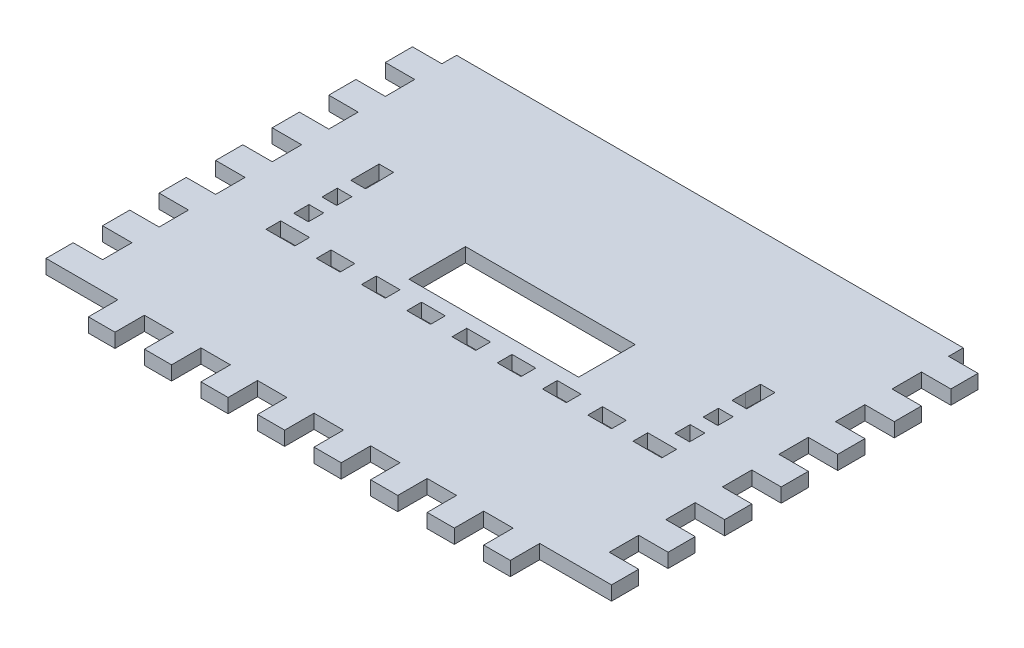
from build123d import *

# Parameters (mm, degrees)
SKETCH1_W           = 127
SKETCH1_H           = 107.95
BOSS_EXTRUDE1_DEPTH = 3.175
SKETCH2_W           = 6.604
SKETCH2_H           = 6.604
CUT_EXTRUDE1_DEPTH  = 84.400427157
SKETCH3_W           = 6.477
SKETCH3_H           = 3.302
SKETCH3_W_2         = 3.302
SKETCH3_H_2         = 3.429
SKETCH3_W_3         = 5.334
SKETCH3_W_4         = 38.1
SKETCH3_H_3         = 12.7
CUT_EXTRUDE2_DEPTH  = 84.400427157


with BuildPart() as part:
    # Sketch1 → Boss-Extrude1 (new body)
    with BuildSketch(Plane(origin=(0, 0, 0), x_dir=(1, 0, 0), z_dir=(0, 1, 0))):
        Rectangle(SKETCH1_W, SKETCH1_H)
    extrude(amount=BOSS_EXTRUDE1_DEPTH)

    # Sketch2 → Cut-Extrude1 (cut, through all)
    with BuildSketch(Plane.XZ):
        with Locations((60.198, 22.225)):
            Rectangle(SKETCH2_W, SKETCH2_H)
        Polygon((63.5, 38.227), (63.5, 31.623), (56.896, 31.623), (47.371, 31.623), (47.371, 38.227), (41.402, 38.227), (41.402, 31.623), (34.798, 31.623), (34.798, 38.227), (28.702, 38.227), (28.702, 31.623), (22.098, 31.623), (22.098, 38.227), (16.002, 38.227), (16.002, 31.623), (9.398, 31.623), (9.398, 38.227), (3.302, 38.227), (3.302, 31.623), (-3.302, 31.623), (-3.302, 38.227), (-9.398, 38.227), (-9.398, 31.623), (-16.002, 31.623), (-16.002, 38.227), (-22.098, 38.227), (-22.098, 31.623), (-28.702, 31.623), (-28.702, 38.227), (-34.798, 38.227), (-34.798, 31.623), (-41.402, 31.623), (-41.402, 38.227), (-47.371, 38.227), (-47.371, 31.623), (-56.896, 31.623), (-63.5, 31.623), (-63.5, 38.227), (-63.5, 53.975), (63.5, 53.975), align=None)
        with Locations((60.198, 9.525)):
            Rectangle(SKETCH2_W, SKETCH2_H)
        with Locations((60.198, -3.175)):
            Rectangle(SKETCH2_W, SKETCH2_H)
        with Locations((60.198, -15.875)):
            Rectangle(SKETCH2_W, SKETCH2_H)
        with Locations((60.198, -28.575)):
            Rectangle(SKETCH2_W, SKETCH2_H)
        with Locations((60.198, -41.275)):
            Rectangle(SKETCH2_W, SKETCH2_H)
        with Locations((60.198, -53.975)):
            Rectangle(SKETCH2_W, SKETCH2_H)
        with Locations((-60.198, -53.975)):
            Rectangle(SKETCH2_W, SKETCH2_H)
        with Locations((-60.198, -41.275)):
            Rectangle(SKETCH2_W, SKETCH2_H)
        with Locations((-60.198, -28.575)):
            Rectangle(SKETCH2_W, SKETCH2_H)
        with Locations((-60.198, -15.875)):
            Rectangle(SKETCH2_W, SKETCH2_H)
        with Locations((-60.198, -3.175)):
            Rectangle(SKETCH2_W, SKETCH2_H)
        with Locations((-60.198, 9.525)):
            Rectangle(SKETCH2_W, SKETCH2_H)
        with Locations((-60.198, 22.225)):
            Rectangle(SKETCH2_W, SKETCH2_H)
    extrude(amount=-CUT_EXTRUDE1_DEPTH, mode=Mode.SUBTRACT)

    # Sketch3 → Cut-Extrude2 (cut, through all)
    with BuildSketch(Plane(origin=(0, 0, 0), x_dir=(1, 0, 0), z_dir=(0, 1, 0))):
        Polygon((44.45, 24.13), (41.2115, 24.13), (41.148, 20.828), (41.148, 17.78), (44.45, 17.78), align=None)
        with Locations((41.2115, 0.381)):
            Rectangle(SKETCH3_W, SKETCH3_H)
        with Locations((42.799, 6.6675)):
            Rectangle(SKETCH3_W_2, SKETCH3_H_2)
        with Locations((42.799, 13.0175)):
            Rectangle(SKETCH3_W_2, SKETCH3_H_2)
        with Locations((30.48, 0.381)):
            Rectangle(SKETCH3_W_3, SKETCH3_H)
        with Locations((20.32, 0.381)):
            Rectangle(SKETCH3_W_3, SKETCH3_H)
        with Locations((10.16, 0.381)):
            Rectangle(SKETCH3_W_3, SKETCH3_H)
        with Locations((0, 0.381)):
            Rectangle(SKETCH3_W_3, SKETCH3_H)
        with Locations((-10.16, 0.381)):
            Rectangle(SKETCH3_W_3, SKETCH3_H)
        with Locations((-20.32, 0.381)):
            Rectangle(SKETCH3_W_3, SKETCH3_H)
        with Locations((-42.799, 13.0175)):
            Rectangle(SKETCH3_W_2, SKETCH3_H_2)
        Polygon((-44.45, 24.13), (-44.45, 17.78), (-41.148, 17.78), (-41.148, 20.828), (-41.2115, 24.13), align=None)
        with Locations((-42.799, 6.6675)):
            Rectangle(SKETCH3_W_2, SKETCH3_H_2)
        with Locations((-30.48, 0.381)):
            Rectangle(SKETCH3_W_3, SKETCH3_H)
        with Locations((-41.2115, 0.381)):
            Rectangle(SKETCH3_W, SKETCH3_H)
        with Locations((0.358722149, 11.43)):
            Rectangle(SKETCH3_W_4, SKETCH3_H_3)
    extrude(amount=CUT_EXTRUDE2_DEPTH, mode=Mode.SUBTRACT)


solid = part.part
